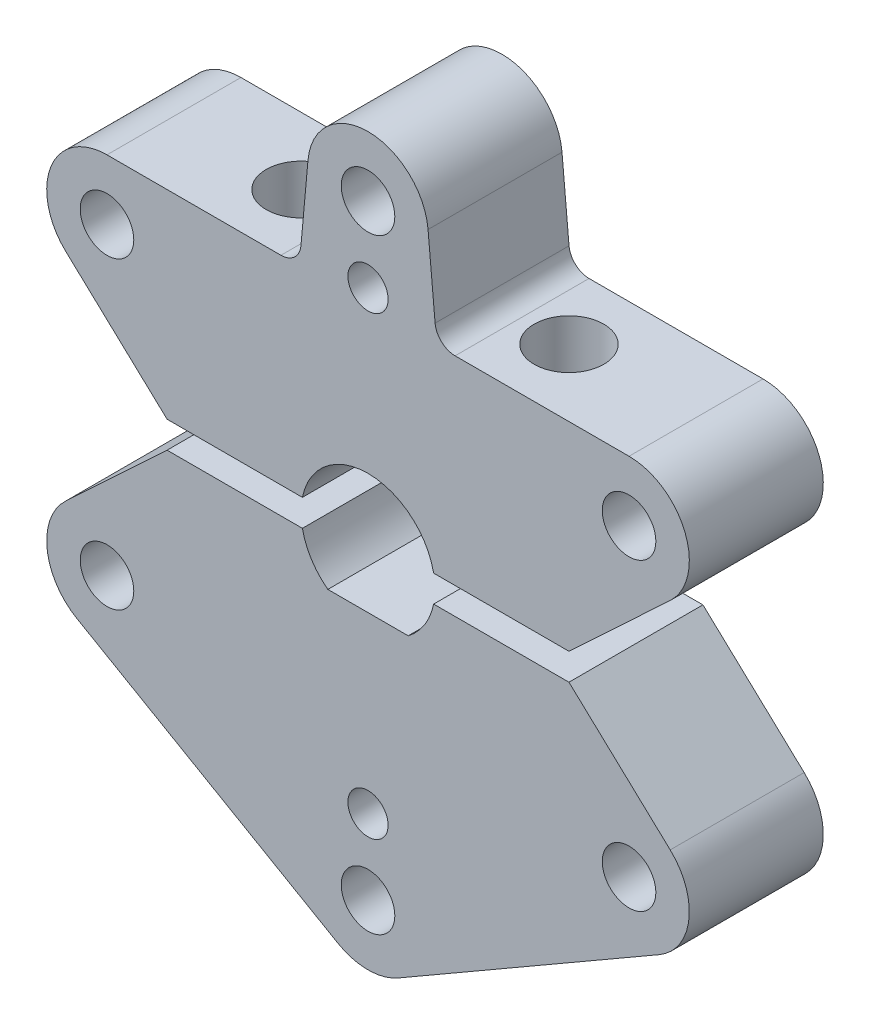
from build123d import *

# Parameters (mm, degrees)
SKETCH_1_R          = 2
EXTRUDE_1_DEPTH     = 10
EXTRUDE_1_2_DEPTH   = 10
SKETCH_2_R          = 2.6
CUT_EXTRUDE_1_DEPTH = 14.85
SKETCH_3_R          = 2
CUT_EXTRUDE_2_DEPTH = 51.199702631
SKETCH_4_R          = 1.5
CUT_EXTRUDE_3_DEPTH = 38.546206789


with BuildPart() as part:
    # 草图1 → 凸台-拉伸1 (new body)
    with BuildSketch(Plane.XY):
        with BuildLine():
            Line((-3, -4), (3, -4))
            ThreePointArc((3, -4), (4.224744871, -2.674234614), (4.898979486, -1))
            Line((4.898979486, -1), (15, -1))
            Line((15, -1), (22.557859125, -8.061983991))
            ThreePointArc((22.557859125, -8.061983991), (23.956389252, -11.861653581), (21.735571585, -15.247114317))
            Line((21.735571585, -15.247114317), (2.25, -26.497114317))
            ThreePointArc((2.25, -26.497114317), (0, -27.1), (-2.25, -26.497114317))
            Line((-2.25, -26.497114317), (-21.735571585, -15.247114317))
            ThreePointArc((-21.735571585, -15.247114317), (-23.956389252, -11.861653581), (-22.557859125, -8.061983991))
            Line((-22.557859125, -8.061983991), (-15, -1))
            Line((-15, -1), (-4.898979486, -1))
            ThreePointArc((-4.898979486, -1), (-4.224744871, -2.674234614), (-3, -4))
        make_face()
        with Locations((-19.485571585, -11.35)):
            Circle(SKETCH_1_R, mode=Mode.SUBTRACT)
        with Locations((0, -22.6)):
            Circle(SKETCH_1_R, mode=Mode.SUBTRACT)
        with Locations((19.485571585, -11.35)):
            Circle(SKETCH_1_R, mode=Mode.SUBTRACT)
    extrude(amount=EXTRUDE_1_DEPTH)

    # 草图3 → 切除-拉伸2 (cut, through all)
    with BuildSketch(Plane(origin=(0, 15.85, 0), x_dir=(1, 0, 0), z_dir=(0, 1, 0))):
        with Locations(Location((-10, -5, 0), (0, 0, 180))):
            Circle(SKETCH_3_R)
        with Locations((10, -5)):
            Circle(SKETCH_3_R)
    extrude(amount=-CUT_EXTRUDE_2_DEPTH, mode=Mode.SUBTRACT)


with BuildPart() as body_2:
    # 草图1 → Extrude 1 2 (new body)
    with BuildSketch(Plane.XY):
        with BuildLine():
            Line((-15, 1), (-22.557859125, 8.061983991))
            ThreePointArc((-22.557859125, 8.061983991), (-23.671624143, 13.001352167), (-19.485571585, 15.85))
            Line((-19.485571585, 15.85), (-6.5, 15.85))
            ThreePointArc((-6.5, 15.85), (-5.488301483, 16.242540696), (-5.006113419, 17.214711852))
            Line((-5.006113419, 17.214711852), (-4.481659743, 23.005864444))
            ThreePointArc((-4.481659743, 23.005864444), (0, 27.1), (4.481659743, 23.005864444))
            Line((4.481659743, 23.005864444), (5.006113419, 17.214711852))
            ThreePointArc((5.006113419, 17.214711852), (5.488301483, 16.242540696), (6.5, 15.85))
            Line((6.5, 15.85), (19.485571585, 15.85))
            ThreePointArc((19.485571585, 15.85), (23.671624143, 13.001352167), (22.557859125, 8.061983991))
            Line((22.557859125, 8.061983991), (15, 1))
            Line((15, 1), (4.898979486, 1))
            ThreePointArc((4.898979486, 1), (0, 5), (-4.898979486, 1))
            Line((-4.898979486, 1), (-15, 1))
        make_face()
        with Locations((-19.485571585, 11.35)):
            Circle(SKETCH_1_R, mode=Mode.SUBTRACT)
        with Locations((0, 22.6)):
            Circle(SKETCH_1_R, mode=Mode.SUBTRACT)
        with Locations((19.485571585, 11.35)):
            Circle(SKETCH_1_R, mode=Mode.SUBTRACT)
    extrude(amount=EXTRUDE_1_2_DEPTH)

    # 草图2 → 切除-拉伸1 (cut)
    with BuildSketch(Plane(origin=(0, 15.85, 0), x_dir=(1, 0, 0), z_dir=(0, 1, 0))):
        with Locations(Location((-10, -5, 0), (0, 0, 180))):
            Circle(SKETCH_2_R)
        with Locations(Location((10, -5, 0), (0, 0, 180))):
            Circle(SKETCH_2_R)
    extrude(amount=-CUT_EXTRUDE_1_DEPTH, mode=Mode.SUBTRACT)


with BuildPart() as cut_extrude_3_tool:
    # 草图4 → 切除-拉伸3 (new, through all)
    with BuildSketch(Plane.XY.offset(10)):
        with Locations((0, -17)):
            Circle(SKETCH_4_R)
        with Locations((0, 17)):
            Circle(SKETCH_4_R)
    extrude(amount=-CUT_EXTRUDE_3_DEPTH)


with BuildPart() as part_1:
    add(part.part)

    # 切除-拉伸3: cut by cut_extrude_3_tool
    add(cut_extrude_3_tool.part, mode=Mode.SUBTRACT)


with BuildPart() as body_2_1:
    add(body_2.part)

    # 切除-拉伸3: cut by cut_extrude_3_tool
    add(cut_extrude_3_tool.part, mode=Mode.SUBTRACT)


solid = Compound([part_1.part, body_2_1.part])
